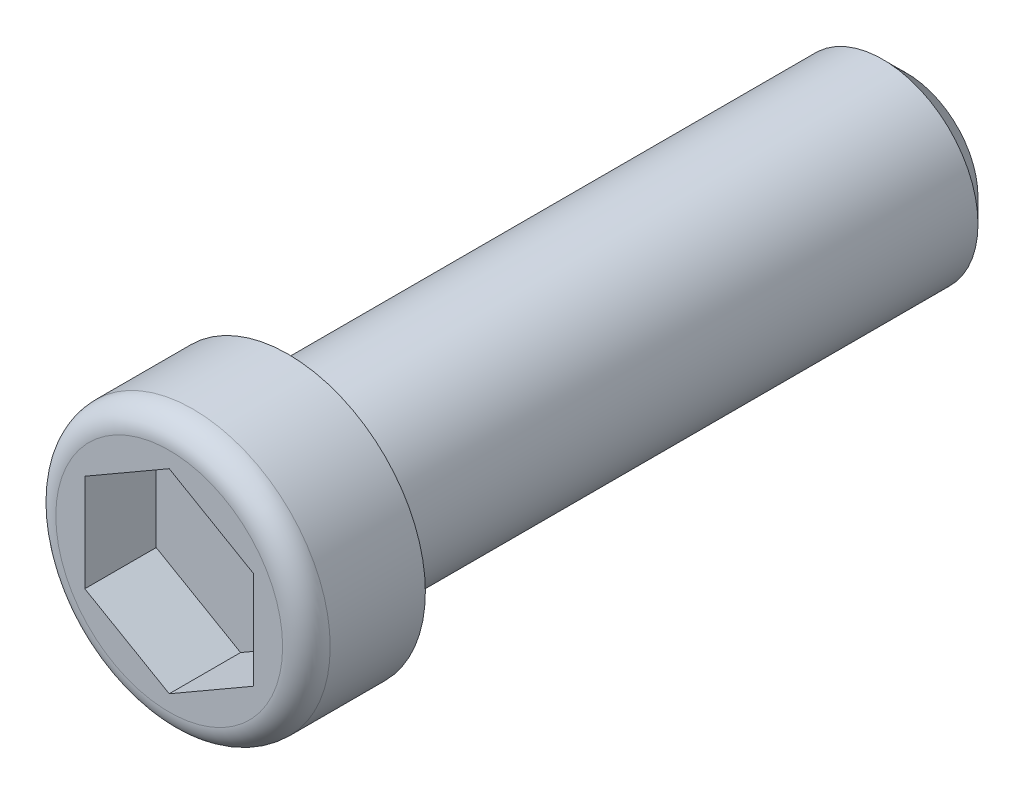
from build123d import *

# Parameters (mm, degrees)
SKETCH_1_R          = 2
EXTRUDE_1_DEPTH     = 13
SKETCH_2_R          = 2.883822271
EXTRUDE_2_DEPTH     = 2.5
CUT_EXTRUDE_1_DEPTH = 1.5
CHAMFER_1_SIZE      = 0.5
FILLET_1_R          = 0.5


with BuildPart() as part:
    # 草图1 → 凸台-拉伸1 (new body)
    with BuildSketch(Plane.XY):
        with Locations(Location((0, 0, 0), (0, 0, 180))):
            Circle(SKETCH_1_R)
    extrude(amount=EXTRUDE_1_DEPTH)

    # 草图2 → 凸台-拉伸2 (add)
    with BuildSketch(Plane.XY.offset(13)):
        Circle(SKETCH_2_R)
    extrude(amount=EXTRUDE_2_DEPTH)

    # 草图3 → 切除-拉伸1 (cut)
    with BuildSketch(Plane.XY.offset(15.5)):
        Polygon((0, 2.048433274), (-1.773995253, 1.024216637), (-1.773995253, -1.024216637), (0, -2.048433274), (1.773995253, -1.024216637), (1.773995253, 1.024216637), align=None)
    extrude(amount=-CUT_EXTRUDE_1_DEPTH, mode=Mode.SUBTRACT)

    # 倒角1
    chamfer_1_edges = [part.edges().sort_by_distance(p)[0] for p in [
        (2, 0, 0),
    ]]
    chamfer(chamfer_1_edges, length=CHAMFER_1_SIZE)

    # 圆角1
    fillet_1_edges = [part.edges().sort_by_distance(p)[0] for p in [
        (-2.883822271, 0, 15.5),
    ]]
    fillet(fillet_1_edges, radius=FILLET_1_R)


solid = part.part
